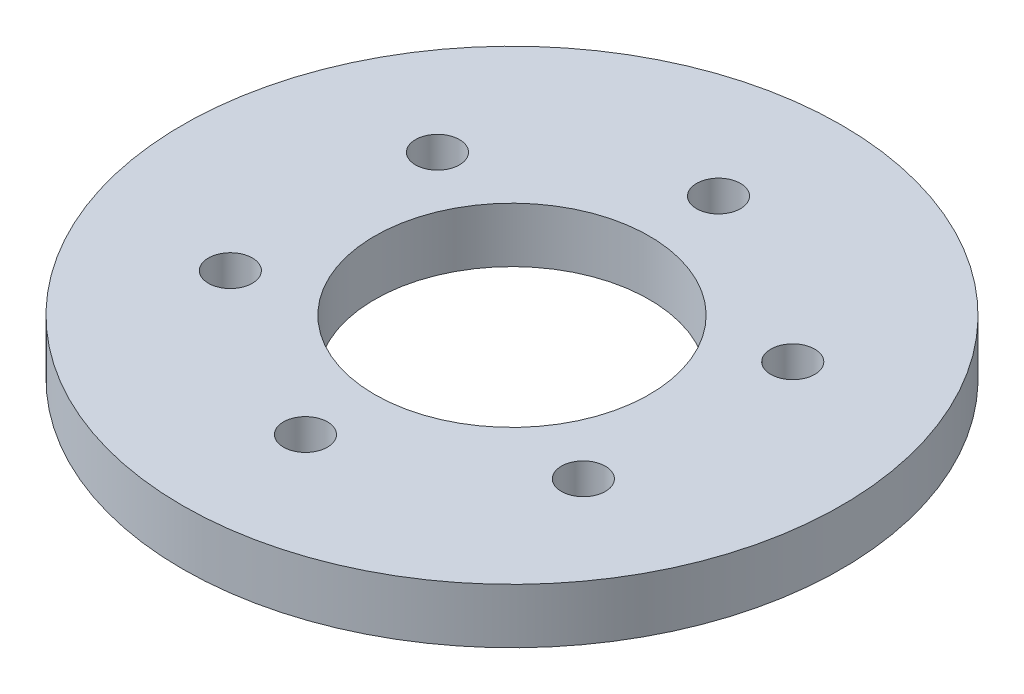
from build123d import *

# Parameters (mm, degrees)
SKETCH1_R           = 38.1
SKETCH1_R_2         = 15.875
SKETCH1_R_3         = 2.54
BOSS_EXTRUDE1_DEPTH = 6.35


with BuildPart() as part:
    # Sketch1 → Boss-Extrude1 (new body)
    with BuildSketch(Plane(origin=(0, 0, 0), x_dir=(1, 0, 0), z_dir=(0, 1, 0))):
        with Locations(Location((0, -6.35, 0), (0, 0, 270))):
            Circle(SKETCH1_R)
        with Locations(Location((0, -6.35, 0), (0, 0, 270))):
            Circle(SKETCH1_R_2, mode=Mode.SUBTRACT)
        with Locations(Location((-20.632030992, 5.665934136, 0), (0, 0, 270))):
            Circle(SKETCH1_R_3, mode=Mode.SUBTRACT)
        with Locations(Location((-20.751184373, -18.15896791, 0), (0, 0, 270))):
            Circle(SKETCH1_R_3, mode=Mode.SUBTRACT)
        with Locations(Location((20.882201741, 5.225708465, 0), (0, 0, 270))):
            Circle(SKETCH1_R_3, mode=Mode.SUBTRACT)
        with Locations(Location((20.496096578, -18.596362769, 0), (0, 0, 270))):
            Circle(SKETCH1_R_3, mode=Mode.SUBTRACT)
        with Locations(Location((0, 17.526, 0), (0, 0, 270))):
            Circle(SKETCH1_R_3, mode=Mode.SUBTRACT)
        with Locations(Location((0, -30.226, 0), (0, 0, 90))):
            Circle(SKETCH1_R_3, mode=Mode.SUBTRACT)
    extrude(amount=BOSS_EXTRUDE1_DEPTH)


solid = part.part
